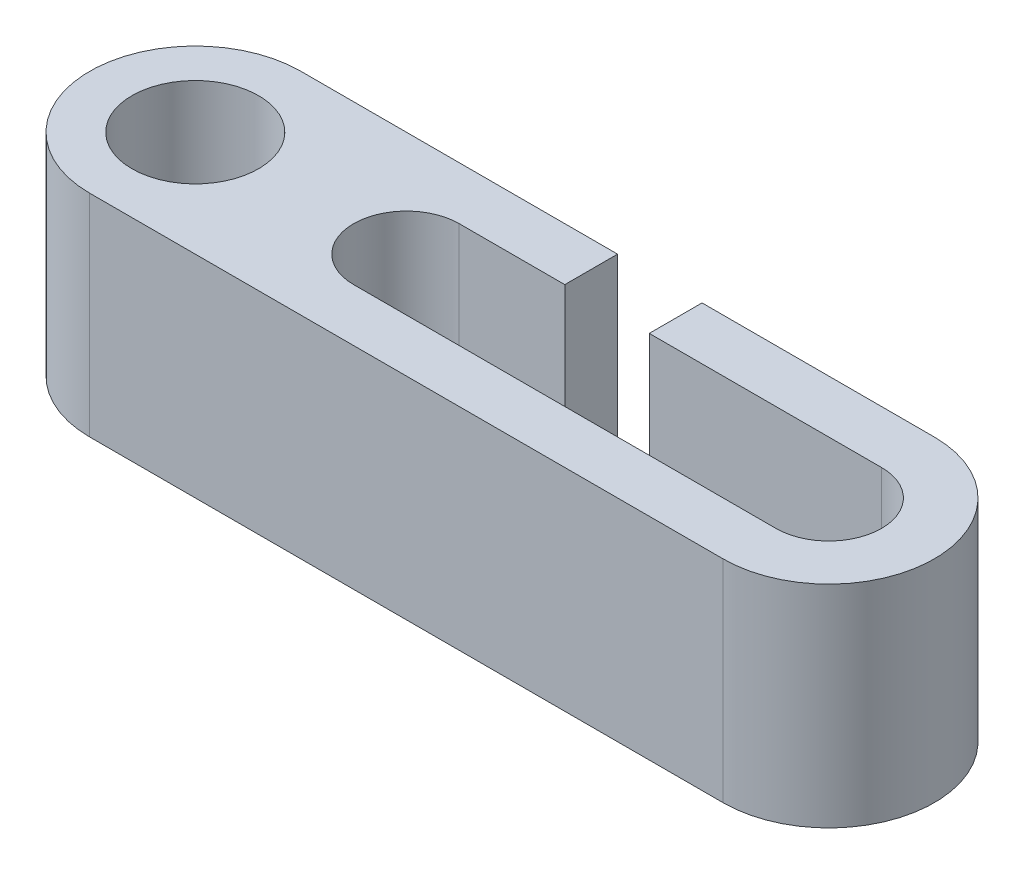
from build123d import *

# Parameters (mm, degrees)
SKETCH1_R           = 3
BOSS_EXTRUDE1_DEPTH = 10


with BuildPart() as part:
    # Sketch1 → Boss-Extrude1 (new body)
    with BuildSketch(Plane(origin=(0, 0, 0), x_dir=(1, 0, 0), z_dir=(0, 1, 0))):
        with BuildLine():
            Line((-45.892533193, 15.021428325), (-30.892533193, 15.021428325))
            Line((-30.892533193, 15.021428325), (-30.892533193, 12.521428325))
            Line((-30.892533193, 12.521428325), (-35.892533193, 12.521428325))
            ThreePointArc((-35.892533193, 12.521428325), (-38.392533193, 10.021428325), (-35.892533193, 7.521428325))
            Line((-35.892533193, 7.521428325), (-15.892533193, 7.521428325))
            ThreePointArc((-15.892533193, 7.521428325), (-13.392533193, 10.021428325), (-15.892533193, 12.521428325))
            Line((-15.892533193, 12.521428325), (-26.892533193, 12.521428325))
            Line((-26.892533193, 12.521428325), (-26.892533193, 15.021428325))
            Line((-26.892533193, 15.021428325), (-15.892533193, 15.021428325))
            ThreePointArc((-15.892533193, 15.021428325), (-10.892533193, 10.021428325), (-15.892533193, 5.021428325))
            Line((-15.892533193, 5.021428325), (-45.892533193, 5.021428325))
            ThreePointArc((-45.892533193, 5.021428325), (-50.892533193, 10.021428325), (-45.892533193, 15.021428325))
        make_face()
        with Locations(Location((-45.892533193, 10.021428325, 0), (0, 0, 270))):
            Circle(SKETCH1_R, mode=Mode.SUBTRACT)
    extrude(amount=BOSS_EXTRUDE1_DEPTH)


solid = part.part
